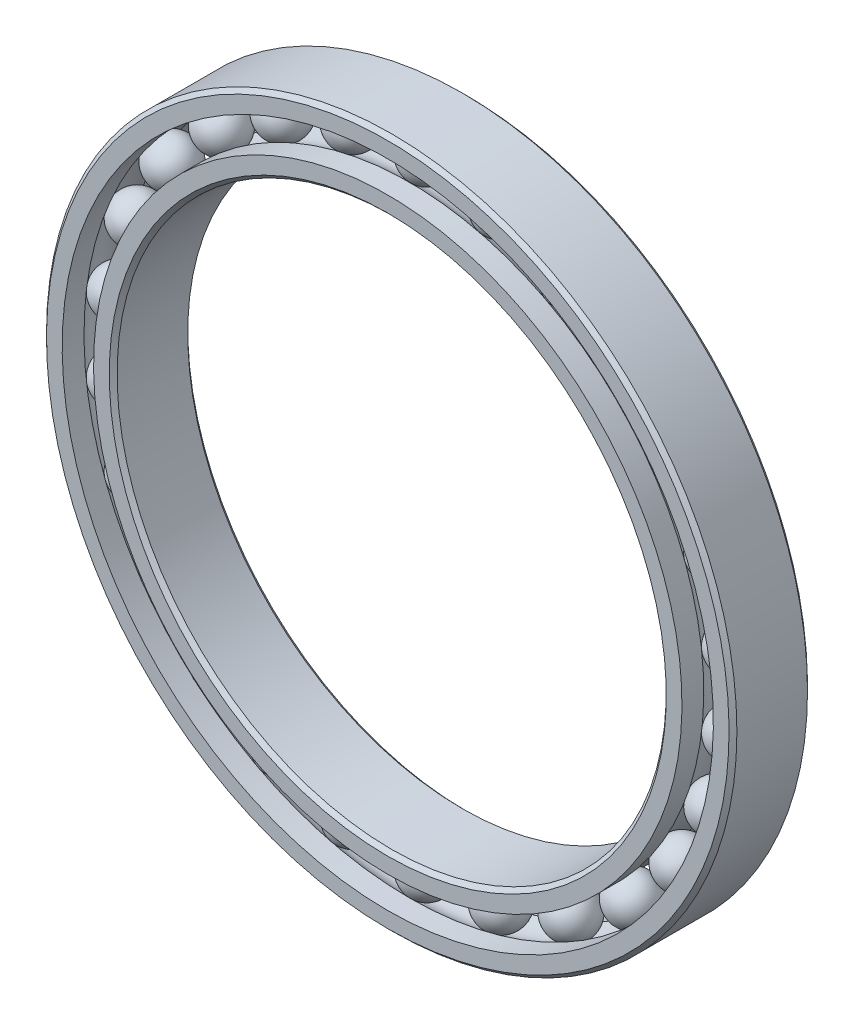
from build123d import *

# Parameters (mm, degrees)
CIRPATTERN1_COUNT = 26


with BuildPart() as part:
    # Sketch6 → Revolve5 (revolve)
    with BuildSketch(Plane(origin=(0, 0, 0), x_dir=(0, 0, -1), z_dir=(1, 0, 0)), mode=Mode.PRIVATE) as revolve5_sk:
        with BuildLine():
            Line((2.25, 22), (2.5, 21.75))
            Line((2.5, 21.75), (2.5, 20.75))
            Line((2.5, 20.75), (1.111111111, 20.75))
            ThreePointArc((1.111111111, 20.75), (0, 21.244847116), (-1.111111111, 20.75))
            Line((-1.111111111, 20.75), (-2.5, 20.75))
            Line((-2.5, 20.75), (-2.5, 21.75))
            Line((-2.5, 21.75), (-2.25, 22))
            Line((-2.25, 22), (2.25, 22))
        make_face()
    revolve(revolve5_sk.sketch.rotate(Axis((0, 0, 2.5), (0, 0, -1)), 180), axis=Axis((0, 0, 2.5), (0, 0, -1)))


with BuildPart() as body_2:
    # Sketch3 → Revolve3 (revolve)
    with BuildSketch(Plane(origin=(0, 0, 0), x_dir=(0, 0, -1), z_dir=(1, 0, 0)), mode=Mode.PRIVATE) as revolve3_sk:
        with BuildLine():
            Line((-2.5, 18.75), (-1.111111111, 18.75))
            ThreePointArc((-1.111111111, 18.75), (0, 18.255152884), (1.111111111, 18.75))
            Line((1.111111111, 18.75), (2.5, 18.75))
            Line((2.5, 18.75), (2.5, 17.75))
            Line((2.5, 17.75), (2.25, 17.5))
            Line((2.25, 17.5), (-2.25, 17.5))
            Line((-2.25, 17.5), (-2.5, 17.75))
            Line((-2.5, 17.75), (-2.5, 18.75))
        make_face()
    revolve(revolve3_sk.sketch.rotate(Axis((0, 0, 2.5), (0, 0, -1)), 180), axis=Axis((0, 0, 2.5), (0, 0, -1)))


with BuildPart() as body_3:
    # Sketch4 → Revolve4 (revolve)
    with BuildSketch(Plane(origin=(0, 0, 0), x_dir=(0, 0, -1), z_dir=(1, 0, 0))):
        with BuildLine():
            Line((-1.494847116, 19.75), (1.494847116, 19.75))
            ThreePointArc((1.494847116, 19.75), (0, 21.244847116), (-1.494847116, 19.75))
        make_face()
    revolve(axis=Axis((0, 19.75, 1.494847116), (0, 0, -1)))


with BuildPart() as cirpattern1_1:
    # CirPattern1: pattern copy
    add(body_3.part.rotate(Axis((0, 0, 0), (0, 0, 1)), 1 * 360 / CIRPATTERN1_COUNT))


with BuildPart() as cirpattern1_2:
    # CirPattern1: pattern copy
    add(body_3.part.rotate(Axis((0, 0, 0), (0, 0, 1)), 2 * 360 / CIRPATTERN1_COUNT))


with BuildPart() as cirpattern1_3:
    # CirPattern1: pattern copy
    add(body_3.part.rotate(Axis((0, 0, 0), (0, 0, 1)), 3 * 360 / CIRPATTERN1_COUNT))


with BuildPart() as cirpattern1_4:
    # CirPattern1: pattern copy
    add(body_3.part.rotate(Axis((0, 0, 0), (0, 0, 1)), 4 * 360 / CIRPATTERN1_COUNT))


with BuildPart() as cirpattern1_5:
    # CirPattern1: pattern copy
    add(body_3.part.rotate(Axis((0, 0, 0), (0, 0, 1)), 5 * 360 / CIRPATTERN1_COUNT))


with BuildPart() as cirpattern1_6:
    # CirPattern1: pattern copy
    add(body_3.part.rotate(Axis((0, 0, 0), (0, 0, 1)), 6 * 360 / CIRPATTERN1_COUNT))


with BuildPart() as cirpattern1_7:
    # CirPattern1: pattern copy
    add(body_3.part.rotate(Axis((0, 0, 0), (0, 0, 1)), 7 * 360 / CIRPATTERN1_COUNT))


with BuildPart() as cirpattern1_8:
    # CirPattern1: pattern copy
    add(body_3.part.rotate(Axis((0, 0, 0), (0, 0, 1)), 8 * 360 / CIRPATTERN1_COUNT))


with BuildPart() as cirpattern1_9:
    # CirPattern1: pattern copy
    add(body_3.part.rotate(Axis((0, 0, 0), (0, 0, 1)), 9 * 360 / CIRPATTERN1_COUNT))


with BuildPart() as cirpattern1_10:
    # CirPattern1: pattern copy
    add(body_3.part.rotate(Axis((0, 0, 0), (0, 0, 1)), 10 * 360 / CIRPATTERN1_COUNT))


with BuildPart() as cirpattern1_11:
    # CirPattern1: pattern copy
    add(body_3.part.rotate(Axis((0, 0, 0), (0, 0, 1)), 11 * 360 / CIRPATTERN1_COUNT))


with BuildPart() as cirpattern1_12:
    # CirPattern1: pattern copy
    add(body_3.part.rotate(Axis((0, 0, 0), (0, 0, 1)), 12 * 360 / CIRPATTERN1_COUNT))


with BuildPart() as cirpattern1_13:
    # CirPattern1: pattern copy
    add(body_3.part.rotate(Axis((0, 0, 0), (0, 0, 1)), 13 * 360 / CIRPATTERN1_COUNT))


with BuildPart() as cirpattern1_14:
    # CirPattern1: pattern copy
    add(body_3.part.rotate(Axis((0, 0, 0), (0, 0, 1)), 14 * 360 / CIRPATTERN1_COUNT))


with BuildPart() as cirpattern1_15:
    # CirPattern1: pattern copy
    add(body_3.part.rotate(Axis((0, 0, 0), (0, 0, 1)), 15 * 360 / CIRPATTERN1_COUNT))


with BuildPart() as cirpattern1_16:
    # CirPattern1: pattern copy
    add(body_3.part.rotate(Axis((0, 0, 0), (0, 0, 1)), 16 * 360 / CIRPATTERN1_COUNT))


with BuildPart() as cirpattern1_17:
    # CirPattern1: pattern copy
    add(body_3.part.rotate(Axis((0, 0, 0), (0, 0, 1)), 17 * 360 / CIRPATTERN1_COUNT))


with BuildPart() as cirpattern1_18:
    # CirPattern1: pattern copy
    add(body_3.part.rotate(Axis((0, 0, 0), (0, 0, 1)), 18 * 360 / CIRPATTERN1_COUNT))


with BuildPart() as cirpattern1_19:
    # CirPattern1: pattern copy
    add(body_3.part.rotate(Axis((0, 0, 0), (0, 0, 1)), 19 * 360 / CIRPATTERN1_COUNT))


with BuildPart() as cirpattern1_20:
    # CirPattern1: pattern copy
    add(body_3.part.rotate(Axis((0, 0, 0), (0, 0, 1)), 20 * 360 / CIRPATTERN1_COUNT))


with BuildPart() as cirpattern1_21:
    # CirPattern1: pattern copy
    add(body_3.part.rotate(Axis((0, 0, 0), (0, 0, 1)), 21 * 360 / CIRPATTERN1_COUNT))


with BuildPart() as cirpattern1_22:
    # CirPattern1: pattern copy
    add(body_3.part.rotate(Axis((0, 0, 0), (0, 0, 1)), 22 * 360 / CIRPATTERN1_COUNT))


with BuildPart() as cirpattern1_23:
    # CirPattern1: pattern copy
    add(body_3.part.rotate(Axis((0, 0, 0), (0, 0, 1)), 23 * 360 / CIRPATTERN1_COUNT))


with BuildPart() as cirpattern1_24:
    # CirPattern1: pattern copy
    add(body_3.part.rotate(Axis((0, 0, 0), (0, 0, 1)), 24 * 360 / CIRPATTERN1_COUNT))


with BuildPart() as cirpattern1_25:
    # CirPattern1: pattern copy
    add(body_3.part.rotate(Axis((0, 0, 0), (0, 0, 1)), 25 * 360 / CIRPATTERN1_COUNT))


solid = Compound([part.part, body_2.part, body_3.part, cirpattern1_1.part, cirpattern1_2.part, cirpattern1_3.part, cirpattern1_4.part, cirpattern1_5.part, cirpattern1_6.part, cirpattern1_7.part, cirpattern1_8.part, cirpattern1_9.part, cirpattern1_10.part, cirpattern1_11.part, cirpattern1_12.part, cirpattern1_13.part, cirpattern1_14.part, cirpattern1_15.part, cirpattern1_16.part, cirpattern1_17.part, cirpattern1_18.part, cirpattern1_19.part, cirpattern1_20.part, cirpattern1_21.part, cirpattern1_22.part, cirpattern1_23.part, cirpattern1_24.part, cirpattern1_25.part])
